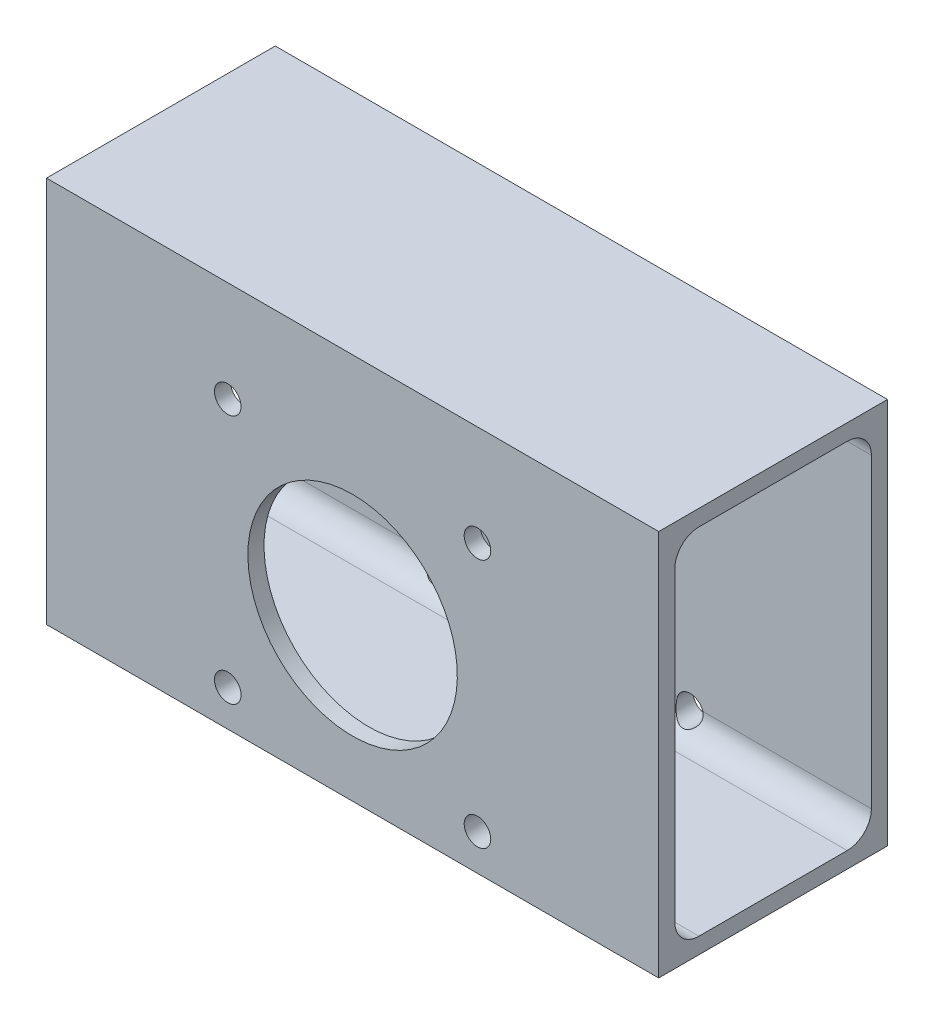
from build123d import *

# Parameters (mm, degrees)
SKETCH_1_W          = 76
SKETCH_1_H          = 48
SKETCH_1_R          = 13
SKETCH_1_R_2        = 1.65
EXTRUDE_1_DEPTH     = 28.4
SKETCH_2_W          = 0.483928257
SKETCH_2_H          = 0.784086289
SKETCH_2_W_2        = 0.466776369
SKETCH_2_W_3        = 1.41135532
SKETCH_2_H_2        = 1.489763949
EXTRUDE_3_DEPTH     = 1
CUT_EXTRUDE_1_DEPTH = 95.781643954


with BuildPart() as part:
    # ｽｹｯﾁ1 → ﾎﾞｽ - 押し出し1 (new body)
    with BuildSketch(Plane.XY):
        with Locations((0, -24)):
            Rectangle(SKETCH_1_W, SKETCH_1_H)
        with Locations(Location((0, -28, 0), (0, 0, 90))):
            Circle(SKETCH_1_R, mode=Mode.SUBTRACT)
        with Locations(Location((-15.5, -43.5, 0), (0, 0, 90))):
            Circle(SKETCH_1_R_2, mode=Mode.SUBTRACT)
        with Locations(Location((15.5, -43.5, 0), (0, 0, 90))):
            Circle(SKETCH_1_R_2, mode=Mode.SUBTRACT)
        with Locations(Location((-15.5, -12.5, 0), (0, 0, 90))):
            Circle(SKETCH_1_R_2, mode=Mode.SUBTRACT)
        with Locations(Location((15.5, -12.5, 0), (0, 0, 90))):
            Circle(SKETCH_1_R_2, mode=Mode.SUBTRACT)
    extrude(amount=EXTRUDE_1_DEPTH)

    # ｽｹｯﾁ2 → ﾎﾞｽ - 押し出し3 (add)
    # profile 1 of 11: a face of its own
    with BuildSketch(Plane.XZ.offset(48)):
        with BuildLine():
            add(Edge.make_bspline(
                [(-23.631625673, 11.719445008), (-23.672407483, 11.710975519), (-23.765455283, 11.691651528), (-23.922971731, 11.667151265), (-24.114995947, 11.64036731), (-24.341594254, 11.610802528), (-24.603031029, 11.58068837), (-24.899094724, 11.548642862), (-25.229581424, 11.51618831), (-25.584808849, 11.481231948), (-25.944222938, 11.44815145), (-26.28765337, 11.417320143), (-26.604968187, 11.390393737), (-26.89653421, 11.366830186), (-27.162462684, 11.347822114), (-27.40206256, 11.329641077), (-27.615740904, 11.317965124), (-27.749302848, 11.3110396), (-27.811785702, 11.307799706)],
                knots=[0, 0, 0, 0, 0.475701385, 1.085360547, 1.820244281, 2.690433318, 3.695453984, 4.826154403, 6.091887677, 7.488515797, 8.903277627, 10.214571399, 11.427062715, 12.540778105, 13.555751846, 14.472349824, 15.28533577, 16, 16, 16, 16], degree=3))
            Line((-27.811785702, 11.307799706), (-27.923272971, 12.248703253))
            add(Edge.make_bspline(
                [(-27.923272971, 12.248703253), (-27.889781615, 12.248928332), (-27.81256085, 12.249447295), (-27.681085412, 12.255313448), (-27.518955616, 12.262464758), (-27.325754706, 12.272137183), (-27.101612868, 12.286224979), (-26.846309596, 12.301538513), (-26.560106242, 12.321811284), (-26.35918603, 12.335717755), (-26.253414202, 12.343038635)],
                knots=[0, 0, 0, 0, 0.480506545, 1.107900303, 1.887993132, 2.809112466, 3.883318085, 5.110299437, 6.478754803, 8, 8, 8, 8], degree=3))
            Line((-26.253414202, 12.343038635), (-26.253414202, 12.954380913))
            Line((-26.253414202, 12.954380913), (-27.794633814, 12.954380913))
            Line((-27.794633814, 12.954380913), (-27.794633814, 13.816875831))
            Line((-27.794633814, 13.816875831), (-26.253414202, 13.816875831))
            Line((-26.253414202, 13.816875831), (-26.253414202, 14.444144863))
            Line((-26.253414202, 14.444144863), (-27.625565208, 14.444144863))
            Line((-27.625565208, 14.444144863), (-27.625565208, 18.442984937))
            Line((-27.625565208, 18.442984937), (-23.792118335, 18.442984937))
            Line((-23.792118335, 18.442984937), (-23.792118335, 14.444144863))
            Line((-23.792118335, 14.444144863), (-25.20714906, 14.444144863))
            Line((-25.20714906, 14.444144863), (-25.20714906, 13.816875831))
            Line((-25.20714906, 13.816875831), (-23.697782954, 13.816875831))
            Line((-23.697782954, 13.816875831), (-23.697782954, 12.954380913))
            Line((-23.697782954, 12.954380913), (-25.20714906, 12.954380913))
            Line((-25.20714906, 12.954380913), (-25.20714906, 12.423897533))
            add(Edge.make_bspline(
                [(-25.20714906, 12.423897533), (-25.102182785, 12.432319665), (-24.903236558, 12.448282425), (-24.621935014, 12.473214518), (-24.373957605, 12.494701059), (-24.16043498, 12.515778657), (-23.980259027, 12.533860909), (-23.83399874, 12.550646423), (-23.721213996, 12.566034058), (-23.657738624, 12.577303729), (-23.631625673, 12.581939926)],
                knots=[0, 0, 0, 0, 1.595667391, 3.024323847, 4.279292849, 5.36732519, 6.275557889, 7.023178268, 7.59814812, 8, 8, 8, 8], degree=3))
            Line((-23.631625673, 12.581939926), (-23.631625673, 11.719445008))
        make_face()
        with Locations((-24.998263573, 17.188446875)):
            Rectangle(SKETCH_2_W, SKETCH_2_H, mode=Mode.SUBTRACT)
        with Locations((-26.453723747, 17.188446875)):
            Rectangle(SKETCH_2_W_2, SKETCH_2_H, mode=Mode.SUBTRACT)
        with Locations((-26.453723747, 15.620274296)):
            Rectangle(SKETCH_2_W_2, SKETCH_2_H, mode=Mode.SUBTRACT)
        with Locations((-24.998263573, 15.620274296)):
            Rectangle(SKETCH_2_W, SKETCH_2_H, mode=Mode.SUBTRACT)
    # profile 2 of 11: a face of its own
    with BuildSketch(Plane.XZ.offset(48)):
        with BuildLine():
            add(Edge.make_bspline(
                [(-19.736922059, 15.785667498), (-19.760912792, 15.650315637), (-19.807370964, 15.388206099), (-19.889827121, 15.010702032), (-19.977910882, 14.661580723), (-20.076047697, 14.341828915), (-20.181940658, 14.050639874), (-20.297019538, 13.788434317), (-20.41777125, 13.553643205), (-20.510802425, 13.41348239), (-20.555312123, 13.346424058)],
                knots=[0, 0, 0, 0, 1.2725683, 2.464334707, 3.576691774, 4.605220691, 5.559773286, 6.443512643, 7.255316498, 8, 8, 8, 8], degree=3))
            Line((-20.555312123, 13.346424058), (-21.370026783, 13.614728585))
            add(Edge.make_bspline(
                [(-21.370026783, 13.614728585), (-21.349191821, 13.658237927), (-21.30375426, 13.753124512), (-21.239606902, 13.911549469), (-21.172839439, 14.097004528), (-21.10442948, 14.300244694), (-21.042367993, 14.504253732), (-20.990841322, 14.690487448), (-20.950779867, 14.849839519), (-20.934931278, 14.948375982), (-20.92775311, 14.993005265)],
                knots=[0, 0, 0, 0, 0.797598512, 1.739428689, 2.824707619, 4.056930485, 5.285298127, 6.350257959, 7.252796348, 8, 8, 8, 8], degree=3))
            Line((-20.92775311, 14.993005265), (-21.385953536, 14.993005265))
            Line((-21.385953536, 14.993005265), (-21.385953536, 11.982848996))
            add(Edge.make_bspline(
                [(-21.385953536, 11.982848996), (-21.388872398, 11.92492413), (-21.394543636, 11.812378326), (-21.442887005, 11.651936456), (-21.521891951, 11.507323949), (-21.631357968, 11.381809778), (-21.765107097, 11.278176899), (-21.921094967, 11.203294829), (-22.096521141, 11.158615046), (-22.220001168, 11.153587348), (-22.283977364, 11.150982448)],
                knots=[0, 0, 0, 0, 1.011667707, 1.965631763, 2.90247982, 3.875044309, 4.858231674, 5.842430935, 6.882142601, 8, 8, 8, 8], degree=3))
            Line((-22.283977364, 11.150982448), (-23.309415214, 11.150982448))
            Line((-23.309415214, 11.150982448), (-23.445405179, 12.170294624))
            Line((-23.445405179, 12.170294624), (-22.742177789, 12.170294624))
            add(Edge.make_bspline(
                [(-22.742177789, 12.170294624), (-22.712867244, 12.173269887), (-22.653750181, 12.179270759), (-22.590585278, 12.22258691), (-22.55089988, 12.265719655), (-22.526509054, 12.300560459), (-22.514015261, 12.33940182), (-22.511763983, 12.365427245), (-22.510627307, 12.378567545)],
                knots=[0, 0, 0, 0, 1.531462238, 3.088838874, 3.880345362, 4.626102435, 5.306315778, 6, 6, 6, 6], degree=3))
            Line((-22.510627307, 12.378567545), (-22.510627307, 14.993005265))
            Line((-22.510627307, 14.993005265), (-23.614473786, 14.993005265))
            Line((-23.614473786, 14.993005265), (-23.614473786, 15.933908812))
            Line((-23.614473786, 15.933908812), (-22.27540142, 15.933908812))
            Line((-22.27540142, 15.933908812), (-23.469907876, 16.816005887))
            Line((-23.469907876, 16.816005887), (-22.799759126, 17.50208139))
            add(Edge.make_bspline(
                [(-22.799759126, 17.50208139), (-22.649268117, 17.407460697), (-22.346589339, 17.21715248), (-22.051388348, 17.015438865), (-21.902960433, 16.914016673)],
                knots=[0, 0, 0, 0, 0.994394191, 2, 2, 2, 2], degree=3))
            add(Edge.make_bspline(
                [(-21.902960433, 16.914016673), (-21.84745151, 16.97288682), (-21.740123737, 17.086713595), (-21.590756017, 17.257239546), (-21.456383294, 17.419715467), (-21.375724043, 17.528292839), (-21.336948143, 17.580490019)],
                knots=[0, 0, 0, 0, 1.109548519, 2.145337448, 3.108394754, 4, 4, 4, 4], degree=3))
            Line((-21.336948143, 17.580490019), (-23.577719741, 17.580490019))
            Line((-23.577719741, 17.580490019), (-23.577719741, 18.442984937))
            Line((-23.577719741, 18.442984937), (-20.215949776, 18.442984937))
            Line((-20.215949776, 18.442984937), (-19.810430148, 18.049716658))
            add(Edge.make_bspline(
                [(-19.810430148, 18.049716658), (-19.8433722, 17.984662005), (-19.911453585, 17.850213458), (-20.035534114, 17.652966914), (-20.177017415, 17.449480601), (-20.338917483, 17.24240719), (-20.519135922, 17.029493295), (-20.721544533, 16.814508379), (-20.941079067, 16.592333692), (-21.098273698, 16.447036442), (-21.17890575, 16.37250708)],
                knots=[0, 0, 0, 0, 0.803533985, 1.660664862, 2.566164627, 3.535183209, 4.557281965, 5.640368919, 6.789641246, 8, 8, 8, 8], degree=3))
            add(Edge.make_bspline(
                [(-21.17890575, 16.37250708), (-21.147746909, 16.347337358), (-21.089332065, 16.300150576), (-21.009128199, 16.23168645), (-20.942813745, 16.169196003), (-20.903932479, 16.128839046), (-20.886098526, 16.110328227)],
                knots=[0, 0, 0, 0, 1.221854775, 2.290664663, 3.21596676, 4, 4, 4, 4], degree=3))
            Line((-20.886098526, 16.110328227), (-21.133575761, 15.933908812))
            Line((-21.133575761, 15.933908812), (-19.930493362, 15.933908812))
            Line((-19.930493362, 15.933908812), (-19.736922059, 15.785667498))
        make_face()
    # profile 3 of 11: a face of its own
    with BuildSketch(Plane.XZ.offset(48)):
        with BuildLine():
            add(Edge.make_bspline(
                [(-11.87890728, 16.914016673), (-11.879658256, 16.79148092), (-11.88113334, 16.550793527), (-11.89835214, 16.196652665), (-11.92157777, 15.856167521), (-11.95725974, 15.529223757), (-12.003654717, 15.216211429), (-12.059859905, 14.916585622), (-12.126027821, 14.63087219), (-12.201134304, 14.35857503), (-12.288956054, 14.10051538), (-12.384849895, 13.855544962), (-12.492245112, 13.624326192), (-12.607739901, 13.405826422), (-12.735712886, 13.201661704), (-12.874080493, 13.012043223), (-13.021920465, 12.83529437), (-13.180737299, 12.671889296), (-13.351556959, 12.518573357), (-13.535128414, 12.374428263), (-13.732486886, 12.238344684), (-13.941608191, 12.107984853), (-14.165206366, 11.987450686), (-14.401184688, 11.872715701), (-14.650985052, 11.767058975), (-14.913417227, 11.667082965), (-15.189911072, 11.577444965), (-15.478774206, 11.492152055), (-15.781876964, 11.416868722), (-16.097729475, 11.348432452), (-16.427000403, 11.286989434), (-16.769436587, 11.23371785), (-17.125118501, 11.186318677), (-17.367019013, 11.16289389), (-17.490024787, 11.150982448)],
                knots=[0, 0, 0, 0, 1.277789657, 2.509862251, 3.696902113, 4.836487642, 5.938717281, 6.99619956, 8.014829667, 8.99649001, 9.940597642, 10.856423965, 11.738678606, 12.597978445, 13.432248646, 14.24918461, 15.044235034, 15.833342977, 16.623484611, 17.436302647, 18.265655617, 19.122503389, 20.004881376, 20.913469895, 21.858000101, 22.832511426, 23.841264369, 24.888447915, 25.973035299, 27.097422524, 28.25850762, 29.46563921, 30.711284214, 32, 32, 32, 32], degree=3))
            Line((-17.490024787, 11.150982448), (-17.759554449, 12.248703253))
            add(Edge.make_bspline(
                [(-17.759554449, 12.248703253), (-17.633308414, 12.264610659), (-17.38913549, 12.295377231), (-17.036249025, 12.346914607), (-16.709410203, 12.400383396), (-16.408325449, 12.456652341), (-16.133473618, 12.515358289), (-15.883406982, 12.574575186), (-15.660027517, 12.63818541), (-15.458678121, 12.703724587), (-15.274880196, 12.774598559), (-15.101962991, 12.851082005), (-14.936232131, 12.931277181), (-14.779028162, 13.018798598), (-14.629421729, 13.11150078), (-14.488143664, 13.211241805), (-14.354771936, 13.316289361), (-14.230112594, 13.426440325), (-14.115476662, 13.53864494), (-14.008164674, 13.647486889), (-13.911384422, 13.754216892), (-13.823905419, 13.857820535), (-13.748012262, 13.960364079), (-13.680367825, 14.058652156), (-13.62344051, 14.154840721), (-13.559537862, 14.283266031), (-13.491184598, 14.458624462), (-13.420870659, 14.692615951), (-13.360985459, 14.959849553), (-13.307698433, 15.254484948), (-13.266298655, 15.569402631), (-13.233856236, 15.894561407), (-13.215414298, 16.226091375), (-13.213047443, 16.448852195), (-13.211853972, 16.561177843)],
                knots=[0, 0, 0, 0, 1.697835875, 3.283790652, 4.758336483, 6.116705303, 7.370352777, 8.508298712, 9.544969538, 10.468596066, 11.332814411, 12.172142381, 12.990984495, 13.788591575, 14.571829565, 15.338321497, 16.09489009, 16.836134439, 17.556762342, 18.23495689, 18.875318702, 19.478822581, 20.043355342, 20.576871157, 21.070312474, 21.533329738, 22.489558138, 23.577274098, 24.79072235, 26.141759394, 27.571317115, 29.027698067, 30.501236695, 32, 32, 32, 32], degree=3))
            Line((-13.211853972, 16.561177843), (-17.68114582, 16.561177843))
            Line((-17.68114582, 16.561177843), (-17.68114582, 14.287327605))
            Line((-17.68114582, 14.287327605), (-18.935683882, 14.287327605))
            Line((-18.935683882, 14.287327605), (-18.935683882, 17.580490019))
            Line((-18.935683882, 17.580490019), (-16.112973241, 17.580490019))
            Line((-16.112973241, 17.580490019), (-16.112973241, 18.599802195))
            Line((-16.112973241, 18.599802195), (-14.858435179, 18.599802195))
            Line((-14.858435179, 18.599802195), (-14.858435179, 17.580490019))
            Line((-14.858435179, 17.580490019), (-11.87890728, 17.580490019))
            Line((-11.87890728, 17.580490019), (-11.87890728, 16.914016673))
        make_face()
    # profile 4 of 11: a face of its own
    with BuildSketch(Plane.XZ.offset(48)):
        with BuildLine():
            Line((-4.351678905, 16.717995101), (-2.861914955, 16.717995101))
            Line((-2.861914955, 16.717995101), (-2.861914955, 15.620274296))
            Line((-2.861914955, 15.620274296), (-4.351678905, 15.620274296))
            Line((-4.351678905, 15.620274296), (-4.351678905, 14.850889625))
            add(Edge.make_bspline(
                [(-4.351678905, 14.850889625), (-4.352586773, 14.7781727), (-4.354373817, 14.635036959), (-4.369501185, 14.423648108), (-4.393816442, 14.218781475), (-4.427877141, 14.020368639), (-4.47233722, 13.828206303), (-4.525828713, 13.642355997), (-4.589514189, 13.463080762), (-4.663672353, 13.290646926), (-4.74681981, 13.12399328), (-4.839745701, 12.963341969), (-4.943324584, 12.80979299), (-5.055746373, 12.662463949), (-5.17945055, 12.522566544), (-5.311143961, 12.387546217), (-5.454061241, 12.260054746), (-5.606279965, 12.138701221), (-5.76738521, 12.023476143), (-5.938710448, 11.917150847), (-6.118037703, 11.816362403), (-6.30612542, 11.721823082), (-6.504281909, 11.636732412), (-6.710309871, 11.556445212), (-6.925906634, 11.484554014), (-7.150845324, 11.419768044), (-7.384484258, 11.360915316), (-7.627248927, 11.309499876), (-7.879088745, 11.265879902), (-8.1395628, 11.22721139), (-8.409428789, 11.198732583), (-8.688004748, 11.175522202), (-8.975537062, 11.157459604), (-9.170515945, 11.153161556), (-9.269370099, 11.150982448)],
                knots=[0, 0, 0, 0, 1.002871967, 1.974049678, 2.921430652, 3.847455874, 4.749249389, 5.640568098, 6.513544215, 7.371490016, 8.227955322, 9.081024337, 9.92931944, 10.781029872, 11.635195341, 12.503507, 13.381050477, 14.274804172, 15.187578089, 16.111236229, 17.05443856, 18.024259569, 19.013129618, 20.027780225, 21.073353784, 22.146495824, 23.25579262, 24.395880272, 25.568251353, 26.780654376, 28.027198101, 29.310289802, 30.636318855, 32, 32, 32, 32], degree=3))
            Line((-9.269370099, 11.150982448), (-9.448239784, 12.248703253))
            add(Edge.make_bspline(
                [(-9.448239784, 12.248703253), (-9.359611967, 12.252548536), (-9.185956617, 12.260082898), (-8.930538389, 12.275214716), (-8.686007405, 12.298143958), (-8.451304385, 12.322763157), (-8.227623716, 12.355308563), (-8.013855963, 12.390491268), (-7.810507789, 12.430204099), (-7.617996958, 12.477537824), (-7.435125782, 12.527344943), (-7.26220176, 12.581784064), (-7.100763064, 12.643553027), (-6.949179907, 12.708244721), (-6.808056946, 12.778164276), (-6.676805384, 12.852486276), (-6.556122596, 12.932439928), (-6.410415438, 13.044420514), (-6.247086738, 13.195275092), (-6.074996428, 13.390679364), (-5.931014347, 13.601054917), (-5.810563295, 13.823816326), (-5.718770963, 14.06150531), (-5.653906405, 14.312699906), (-5.613823928, 14.577214797), (-5.608786305, 14.758452824), (-5.606216967, 14.850889625)],
                knots=[0, 0, 0, 0, 1.220145791, 2.390726203, 3.518632814, 4.597912363, 5.636114818, 6.626924402, 7.577563675, 8.484868763, 9.352882675, 10.184211579, 10.977040721, 11.7293187, 12.450245001, 13.14205069, 13.802571838, 14.439556109, 15.667896769, 16.854125683, 18.013276806, 19.166711843, 20.329734943, 21.508172274, 22.729093516, 24, 24, 24, 24], degree=3))
            Line((-5.606216967, 14.850889625), (-5.606216967, 15.620274296))
            Line((-5.606216967, 15.620274296), (-8.115293092, 15.620274296))
            Line((-8.115293092, 15.620274296), (-8.115293092, 13.581649945))
            Line((-8.115293092, 13.581649945), (-9.369831155, 13.581649945))
            Line((-9.369831155, 13.581649945), (-9.369831155, 15.620274296))
            Line((-9.369831155, 15.620274296), (-10.859595104, 15.620274296))
            Line((-10.859595104, 15.620274296), (-10.859595104, 16.717995101))
            Line((-10.859595104, 16.717995101), (-9.369831155, 16.717995101))
            Line((-9.369831155, 16.717995101), (-9.369831155, 18.364576308))
            Line((-9.369831155, 18.364576308), (-8.115293092, 18.364576308))
            Line((-8.115293092, 18.364576308), (-8.115293092, 16.717995101))
            Line((-8.115293092, 16.717995101), (-5.606216967, 16.717995101))
            Line((-5.606216967, 16.717995101), (-5.606216967, 18.521393566))
            Line((-5.606216967, 18.521393566), (-4.351678905, 18.521393566))
            Line((-4.351678905, 18.521393566), (-4.351678905, 16.717995101))
        make_face()
    # profile 5 of 11: a face of its own
    with BuildSketch(Plane.XZ.offset(48)):
        Polygon((5.449399709, 13.973693089), (2.197891879, 13.647807225), (2.415965878, 11.173034875), (1.146726198, 11.07257382), (0.936003008, 13.522843473), (-2.426992092, 13.1896068), (-2.54828044, 14.287327605), (0.842892761, 14.611988334), (0.720379278, 16.039270407), (-2.156237295, 15.777091554), (-2.229745385, 16.874812359), (0.626043896, 17.133315807), (0.509656088, 18.49199033), (1.761743881, 18.599802195), (1.880581959, 17.247253346), (4.644486128, 17.50208139), (4.743722049, 16.404360586), (1.97736761, 16.154433081), (2.102331363, 14.738177221), (5.341587845, 15.071413894), align=None)
    # profile 6 of 11: a face of its own
    with BuildSketch(Plane.XZ.offset(48)):
        with BuildLine():
            Line((5.527808338, 17.801014288), (4.932392812, 17.580490019))
            add(Edge.make_bspline(
                [(4.932392812, 17.580490019), (4.885098207, 17.698303382), (4.793094582, 17.927489274), (4.651055168, 18.257997532), (4.510305944, 18.566510298), (4.413404294, 18.762969339), (4.366380523, 18.858305643)],
                knots=[0, 0, 0, 0, 1.089675213, 2.119778088, 3.08757873, 4, 4, 4, 4], degree=3))
            Line((4.366380523, 18.858305643), (4.932392812, 19.070253969))
            add(Edge.make_bspline(
                [(4.932392812, 19.070253969), (4.987448251, 18.962201757), (5.096070222, 18.749019471), (5.251449823, 18.429845617), (5.394107041, 18.114378203), (5.483658366, 17.90449128), (5.527808338, 17.801014288)],
                knots=[0, 0, 0, 0, 1.037710732, 2.047357859, 3.037321938, 4, 4, 4, 4], degree=3))
        make_face()
    # profile 7 of 11: a face of its own
    with BuildSketch(Plane.XZ.offset(48)):
        with BuildLine():
            Line((4.273270276, 17.650322704), (3.669278806, 17.423672761))
            add(Edge.make_bspline(
                [(3.669278806, 17.423672761), (3.642437011, 17.489875292), (3.590147041, 17.618843137), (3.512096321, 17.806046924), (3.435701991, 17.981296806), (3.36358425, 18.145125547), (3.295688964, 18.297775122), (3.227516581, 18.437111896), (3.164158932, 18.565930762), (3.122162984, 18.647638144), (3.102041381, 18.686786768)],
                knots=[0, 0, 0, 0, 1.237734868, 2.411206884, 3.514034131, 4.550008275, 5.512714064, 6.408309193, 7.237369962, 8, 8, 8, 8], degree=3))
            Line((3.102041381, 18.686786768), (3.690106098, 18.913436711))
            add(Edge.make_bspline(
                [(3.690106098, 18.913436711), (3.744188976, 18.809185653), (3.851855725, 18.60164543), (4.002413714, 18.286150378), (4.143404162, 17.969545631), (4.230143219, 17.756333), (4.273270276, 17.650322704)],
                knots=[0, 0, 0, 0, 1.012481143, 2.01562043, 3.013357396, 4, 4, 4, 4], degree=3))
        make_face()
    # profile 8 of 11: a face of its own
    with BuildSketch(Plane.XZ.offset(48)):
        Polygon((13.760714374, 16.404360586), (11.775995955, 11.621434222), (10.561887341, 11.621434222), (8.585744866, 16.404360586), (9.962796411, 16.404360586), (11.214884204, 13.094046284), (12.453495514, 16.404360586), align=None)
    # profile 9 of 11: a face of its own
    with BuildSketch(Plane.XZ.offset(48)):
        with BuildLine():
            add(Edge.make_bspline(
                [(16.622629329, 11.464616964), (16.519619824, 11.466950926), (16.320302674, 11.471467001), (16.031636247, 11.506666619), (15.764448136, 11.56793173), (15.517817324, 11.652466392), (15.291091719, 11.75974921), (15.087680029, 11.895101094), (14.904245573, 12.05263817), (14.743233993, 12.236955353), (14.602480059, 12.447958712), (14.481843419, 12.687366564), (14.378333805, 12.955169783), (14.297038183, 13.252765016), (14.23043429, 13.57839409), (14.185021411, 13.933408333), (14.158536691, 14.317547784), (14.154729385, 14.583357864), (14.152757519, 14.721025334)],
                knots=[0, 0, 0, 0, 1.05217903, 2.035902667, 2.964954839, 3.847622708, 4.694791394, 5.519820226, 6.336174683, 7.158011656, 8.011964144, 8.920633821, 9.891426755, 10.940159268, 12.068467807, 13.284562683, 14.593629772, 16, 16, 16, 16], degree=3))
            add(Edge.make_bspline(
                [(14.152757519, 14.721025334), (14.15458967, 14.857475158), (14.158126506, 15.120881709), (14.186493048, 15.501692538), (14.232318741, 15.854031815), (14.295980578, 16.17834063), (14.380480557, 16.473836465), (14.482828898, 16.741311696), (14.604173259, 16.980702927), (14.74420986, 17.193369563), (14.907200225, 17.377758074), (15.08913395, 17.538769625), (15.294304036, 17.673104573), (15.51922659, 17.783813312), (15.766097145, 17.868113943), (16.032945176, 17.928883386), (16.321019744, 17.966067396), (16.520011586, 17.970333292), (16.622629329, 17.972533164)],
                knots=[0, 0, 0, 0, 1.396814709, 2.696450111, 3.906834973, 5.032610411, 6.076667691, 7.049520124, 7.960117508, 8.819357183, 9.648838043, 10.472418511, 11.299197609, 12.15182058, 13.032409769, 13.963432889, 14.949766393, 16, 16, 16, 16], degree=3))
            add(Edge.make_bspline(
                [(16.622629329, 17.972533164), (16.725262169, 17.970389928), (16.924283288, 17.966233858), (17.212062149, 17.928290786), (17.479670882, 17.870208583), (17.72539763, 17.783070501), (17.951332097, 17.674720208), (18.155539631, 17.540152052), (18.337401883, 17.37994284), (18.499243497, 17.195551806), (18.641695828, 16.984658152), (18.762264646, 16.744875257), (18.864827156, 16.477545098), (18.949263402, 16.182006091), (19.012944303, 15.85771019), (19.058764309, 15.505367061), (19.087132517, 15.124557361), (19.090669113, 14.861150647), (19.09250114, 14.724700738)],
                knots=[0, 0, 0, 0, 1.050787132, 2.037640482, 2.96822399, 3.85065652, 4.701891065, 5.529105916, 6.347217128, 7.177135165, 8.03568712, 8.946764433, 9.920129608, 10.964737157, 12.091105933, 13.302128728, 14.602449101, 16, 16, 16, 16], degree=3))
            add(Edge.make_bspline(
                [(19.09250114, 14.724700738), (19.090501812, 14.586222253), (19.086640694, 14.318791528), (19.060536306, 13.932538067), (19.013998902, 13.575809239), (18.950720825, 13.248168425), (18.866086366, 12.950804867), (18.765018695, 12.682183132), (18.644183293, 12.443332003), (18.503347901, 12.233099312), (18.341801619, 12.050669624), (18.160395346, 11.892042933), (17.956143925, 11.758792938), (17.729946929, 11.651229399), (17.483415339, 11.566374082), (17.215494074, 11.50697153), (16.926199464, 11.471369776), (16.726054411, 11.466917619), (16.622629329, 11.464616964)],
                knots=[0, 0, 0, 0, 1.412668533, 2.72815643, 3.946625343, 5.080651102, 6.129003459, 7.096898068, 8.004255257, 8.853517411, 9.671041949, 10.48307082, 11.30461905, 12.150564081, 13.03195702, 13.958740755, 14.945178003, 16, 16, 16, 16], degree=3))
        make_face()
        with BuildLine():
            add(Edge.make_bspline(
                [(16.622629329, 17.031629617), (16.57675961, 17.030113518), (16.487922141, 17.027177238), (16.359868149, 17.000728174), (16.242020774, 16.957690049), (16.133534774, 16.897030584), (16.036569854, 16.817217801), (15.948131115, 16.721601341), (15.87138981, 16.608098231), (15.804816506, 16.476990589), (15.747246928, 16.32750999), (15.699725805, 16.157714451), (15.656144028, 15.968640424), (15.622971178, 15.758149221), (15.595844706, 15.527261582), (15.578872345, 15.275789029), (15.565509171, 15.004173545), (15.564590126, 14.8161969), (15.564112839, 14.718575064)],
                knots=[0, 0, 0, 0, 0.775533796, 1.502003094, 2.201680837, 2.891735835, 3.594376668, 4.318211436, 5.088802721, 5.90478944, 6.80187957, 7.794842537, 8.886265426, 10.08377125, 11.398755049, 12.819282017, 14.348159012, 16, 16, 16, 16], degree=3))
            add(Edge.make_bspline(
                [(15.564112839, 14.718575064), (15.564645773, 14.621365989), (15.565674041, 14.433806163), (15.578354786, 14.162511122), (15.597560573, 13.911605615), (15.623620658, 13.680871849), (15.659408531, 13.470792514), (15.701150532, 13.280561503), (15.752470596, 13.110999941), (15.811171404, 12.961074671), (15.878089155, 12.829634513), (15.956313053, 12.716659022), (16.042942083, 12.620170664), (16.140594945, 12.541338806), (16.247448682, 12.479459443), (16.36441398, 12.436677285), (16.49032878, 12.409916912), (16.577566694, 12.407017961), (16.622629329, 12.405520511)],
                knots=[0, 0, 0, 0, 1.648053165, 3.17983241, 4.603577983, 5.91418064, 7.115097978, 8.215345636, 9.21413735, 10.115460546, 10.942325816, 11.708676953, 12.438991197, 13.133227952, 13.828016948, 14.522529878, 15.236814646, 16, 16, 16, 16], degree=3))
            add(Edge.make_bspline(
                [(16.622629329, 12.405520511), (16.667726517, 12.406866285), (16.755116508, 12.409474147), (16.880638964, 12.438353397), (16.998166945, 12.480383235), (17.104702009, 12.543936743), (17.202311874, 12.623913259), (17.289375839, 12.721743091), (17.366748478, 12.836902253), (17.434444397, 12.969924922), (17.492479495, 13.121765289), (17.54396294, 13.292437017), (17.586019032, 13.483425174), (17.621397661, 13.693567373), (17.647746603, 13.923846963), (17.666937665, 14.173944436), (17.679543232, 14.444016187), (17.680600225, 14.630758882), (17.68114582, 14.727151008)],
                knots=[0, 0, 0, 0, 0.761723091, 1.476078139, 2.169260382, 2.866187449, 3.563457069, 4.297497367, 5.073784015, 5.9052053, 6.817663378, 7.821154784, 8.919294366, 10.12472479, 11.425952641, 12.840080595, 14.368924951, 16, 16, 16, 16], degree=3))
            add(Edge.make_bspline(
                [(17.68114582, 14.727151008), (17.68065409, 14.824363056), (17.679705322, 15.011928621), (17.666494803, 15.282746235), (17.649203647, 15.533350588), (17.62298348, 15.763251863), (17.586789428, 15.97233973), (17.54637549, 16.161805393), (17.496630781, 16.330648065), (17.439049284, 16.47977281), (17.372840914, 16.610012146), (17.296783449, 16.723236927), (17.209070099, 16.818526506), (17.111300442, 16.896905575), (17.003291658, 16.957757761), (16.8853755, 17.000709274), (16.757340629, 17.027182415), (16.668500448, 17.030115281), (16.622629329, 17.031629617)],
                knots=[0, 0, 0, 0, 1.649702535, 3.183014784, 4.600750281, 5.912664589, 7.107950964, 8.201024903, 9.198820206, 10.09205561, 10.910409496, 11.673603693, 12.399538297, 13.099875273, 13.791932112, 14.493639612, 15.22221639, 16, 16, 16, 16], degree=3))
        make_face(mode=Mode.SUBTRACT)
    # profile 10 of 11: a face of its own
    with BuildSketch(Plane.XZ.offset(48)):
        with Locations((20.974308234, 12.366316197)):
            Rectangle(SKETCH_2_W_3, SKETCH_2_H_2)
    # profile 11 of 11: a face of its own
    with BuildSketch(Plane.XZ.offset(48)):
        with BuildLine():
            add(Edge.make_bspline(
                [(25.24757851, 11.464616964), (25.144569005, 11.466950926), (24.945251855, 11.471467001), (24.656585428, 11.506666619), (24.389397316, 11.56793173), (24.142766504, 11.652466392), (23.916040899, 11.75974921), (23.71262921, 11.895101094), (23.529194753, 12.05263817), (23.368183173, 12.236955353), (23.227429239, 12.447958712), (23.106792599, 12.687366564), (23.003282986, 12.955169783), (22.921987363, 13.252765016), (22.85538347, 13.57839409), (22.809970591, 13.933408333), (22.783485871, 14.317547784), (22.779678566, 14.583357864), (22.777706699, 14.721025334)],
                knots=[0, 0, 0, 0, 1.05217903, 2.035902667, 2.964954839, 3.847622708, 4.694791394, 5.519820226, 6.336174683, 7.158011656, 8.011964144, 8.920633821, 9.891426755, 10.940159268, 12.068467807, 13.284562683, 14.593629772, 16, 16, 16, 16], degree=3))
            add(Edge.make_bspline(
                [(22.777706699, 14.721025334), (22.77953885, 14.857475158), (22.783075686, 15.120881709), (22.811442229, 15.501692538), (22.857267922, 15.854031815), (22.920929759, 16.17834063), (23.005429738, 16.473836465), (23.107778079, 16.741311696), (23.229122439, 16.980702927), (23.36915904, 17.193369563), (23.532149405, 17.377758074), (23.71408313, 17.538769625), (23.919253216, 17.673104573), (24.144175771, 17.783813312), (24.391046326, 17.868113943), (24.657894356, 17.928883386), (24.945968924, 17.966067396), (25.144960767, 17.970333292), (25.24757851, 17.972533164)],
                knots=[0, 0, 0, 0, 1.396814709, 2.696450111, 3.906834973, 5.032610411, 6.076667691, 7.049520124, 7.960117508, 8.819357183, 9.648838043, 10.472418511, 11.299197609, 12.15182058, 13.032409769, 13.963432889, 14.949766393, 16, 16, 16, 16], degree=3))
            add(Edge.make_bspline(
                [(25.24757851, 17.972533164), (25.35021135, 17.970389928), (25.549232468, 17.966233858), (25.837011329, 17.928290786), (26.104620063, 17.870208583), (26.35034681, 17.783070501), (26.576281277, 17.674720208), (26.780488812, 17.540152052), (26.962351063, 17.37994284), (27.124192677, 17.195551806), (27.266645009, 16.984658152), (27.387213827, 16.744875257), (27.489776336, 16.477545098), (27.574212582, 16.182006091), (27.637893483, 15.85771019), (27.683713489, 15.505367061), (27.712081697, 15.124557361), (27.715618293, 14.861150647), (27.71745032, 14.724700738)],
                knots=[0, 0, 0, 0, 1.050787132, 2.037640482, 2.96822399, 3.85065652, 4.701891065, 5.529105916, 6.347217128, 7.177135165, 8.03568712, 8.946764433, 9.920129608, 10.964737157, 12.091105933, 13.302128728, 14.602449101, 16, 16, 16, 16], degree=3))
            add(Edge.make_bspline(
                [(27.71745032, 14.724700738), (27.715450992, 14.586222253), (27.711589875, 14.318791528), (27.685485486, 13.932538067), (27.638948082, 13.575809239), (27.575670005, 13.248168425), (27.491035546, 12.950804867), (27.389967875, 12.682183132), (27.269132473, 12.443332003), (27.128297081, 12.233099312), (26.966750799, 12.050669624), (26.785344526, 11.892042933), (26.581093106, 11.758792938), (26.354896109, 11.651229399), (26.10836452, 11.566374082), (25.840443254, 11.50697153), (25.551148644, 11.471369776), (25.351003591, 11.466917619), (25.24757851, 11.464616964)],
                knots=[0, 0, 0, 0, 1.412668533, 2.72815643, 3.946625343, 5.080651102, 6.129003459, 7.096898068, 8.004255257, 8.853517411, 9.671041949, 10.48307082, 11.30461905, 12.150564081, 13.03195702, 13.958740755, 14.945178003, 16, 16, 16, 16], degree=3))
        make_face()
        with BuildLine():
            add(Edge.make_bspline(
                [(25.24757851, 17.031629617), (25.201708791, 17.030113518), (25.112871322, 17.027177238), (24.98481733, 17.000728174), (24.866969954, 16.957690049), (24.758483954, 16.897030584), (24.661519034, 16.817217801), (24.573080295, 16.721601341), (24.49633899, 16.608098231), (24.429765686, 16.476990589), (24.372196108, 16.32750999), (24.324674985, 16.157714451), (24.281093208, 15.968640424), (24.247920358, 15.758149221), (24.220793886, 15.527261582), (24.203821525, 15.275789029), (24.190458352, 15.004173545), (24.189539307, 14.8161969), (24.189062019, 14.718575064)],
                knots=[0, 0, 0, 0, 0.775533796, 1.502003094, 2.201680837, 2.891735835, 3.594376668, 4.318211436, 5.088802721, 5.90478944, 6.80187957, 7.794842537, 8.886265426, 10.08377125, 11.398755049, 12.819282017, 14.348159012, 16, 16, 16, 16], degree=3))
            add(Edge.make_bspline(
                [(24.189062019, 14.718575064), (24.189594953, 14.621365989), (24.190623221, 14.433806163), (24.203303966, 14.162511122), (24.222509753, 13.911605615), (24.248569839, 13.680871849), (24.284357711, 13.470792514), (24.326099713, 13.280561503), (24.377419776, 13.110999941), (24.436120584, 12.961074671), (24.503038335, 12.829634513), (24.581262234, 12.716659022), (24.667891264, 12.620170664), (24.765544125, 12.541338806), (24.872397863, 12.479459443), (24.989363161, 12.436677285), (25.11527796, 12.409916912), (25.202515874, 12.407017961), (25.24757851, 12.405520511)],
                knots=[0, 0, 0, 0, 1.648053165, 3.17983241, 4.603577983, 5.91418064, 7.115097978, 8.215345636, 9.21413735, 10.115460546, 10.942325816, 11.708676953, 12.438991197, 13.133227952, 13.828016948, 14.522529878, 15.236814646, 16, 16, 16, 16], degree=3))
            add(Edge.make_bspline(
                [(25.24757851, 12.405520511), (25.292675698, 12.406866285), (25.380065688, 12.409474147), (25.505588145, 12.438353397), (25.623116125, 12.480383235), (25.729651189, 12.543936743), (25.827261054, 12.623913259), (25.914325019, 12.721743091), (25.991697658, 12.836902253), (26.059393578, 12.969924922), (26.117428675, 13.121765289), (26.16891212, 13.292437017), (26.210968212, 13.483425174), (26.246346841, 13.693567373), (26.272695783, 13.923846963), (26.291886845, 14.173944436), (26.304492412, 14.444016187), (26.305549405, 14.630758882), (26.306095, 14.727151008)],
                knots=[0, 0, 0, 0, 0.761723091, 1.476078139, 2.169260382, 2.866187449, 3.563457069, 4.297497367, 5.073784015, 5.9052053, 6.817663378, 7.821154784, 8.919294366, 10.12472479, 11.425952641, 12.840080595, 14.368924951, 16, 16, 16, 16], degree=3))
            add(Edge.make_bspline(
                [(26.306095, 14.727151008), (26.30560327, 14.824363056), (26.304654503, 15.011928621), (26.291443984, 15.282746235), (26.274152827, 15.533350588), (26.24793266, 15.763251863), (26.211738608, 15.97233973), (26.17132467, 16.161805393), (26.121579961, 16.330648065), (26.063998465, 16.47977281), (25.997790095, 16.610012146), (25.92173263, 16.723236927), (25.834019279, 16.818526506), (25.736249622, 16.896905575), (25.628240839, 16.957757761), (25.51032468, 17.000709274), (25.38228981, 17.027182415), (25.293449629, 17.030115281), (25.24757851, 17.031629617)],
                knots=[0, 0, 0, 0, 1.649702535, 3.183014784, 4.600750281, 5.912664589, 7.107950964, 8.201024903, 9.198820206, 10.09205561, 10.910409496, 11.673603693, 12.399538297, 13.099875273, 13.791932112, 14.493639612, 15.22221639, 16, 16, 16, 16], degree=3))
        make_face(mode=Mode.SUBTRACT)
    extrude(amount=EXTRUDE_3_DEPTH)

    # ｽｹｯﾁ3 → ｶｯﾄ - 押し出し1 (cut, through all)
    with BuildSketch(Plane.ZY.offset(38)):
        with BuildLine():
            Line((5, -46), (23.4, -46))
            ThreePointArc((23.4, -46), (25.521320344, -45.121320344), (26.4, -43))
            Line((26.4, -43), (26.4, -5))
            ThreePointArc((26.4, -5), (25.521320344, -2.878679656), (23.4, -2))
            Line((23.4, -2), (5, -2))
            ThreePointArc((5, -2), (2.878679656, -2.878679656), (2, -5))
            Line((2, -5), (2, -43))
            ThreePointArc((2, -43), (2.878679656, -45.121320344), (5, -46))
        make_face()
    extrude(amount=-CUT_EXTRUDE_1_DEPTH, mode=Mode.SUBTRACT)


solid = part.part
